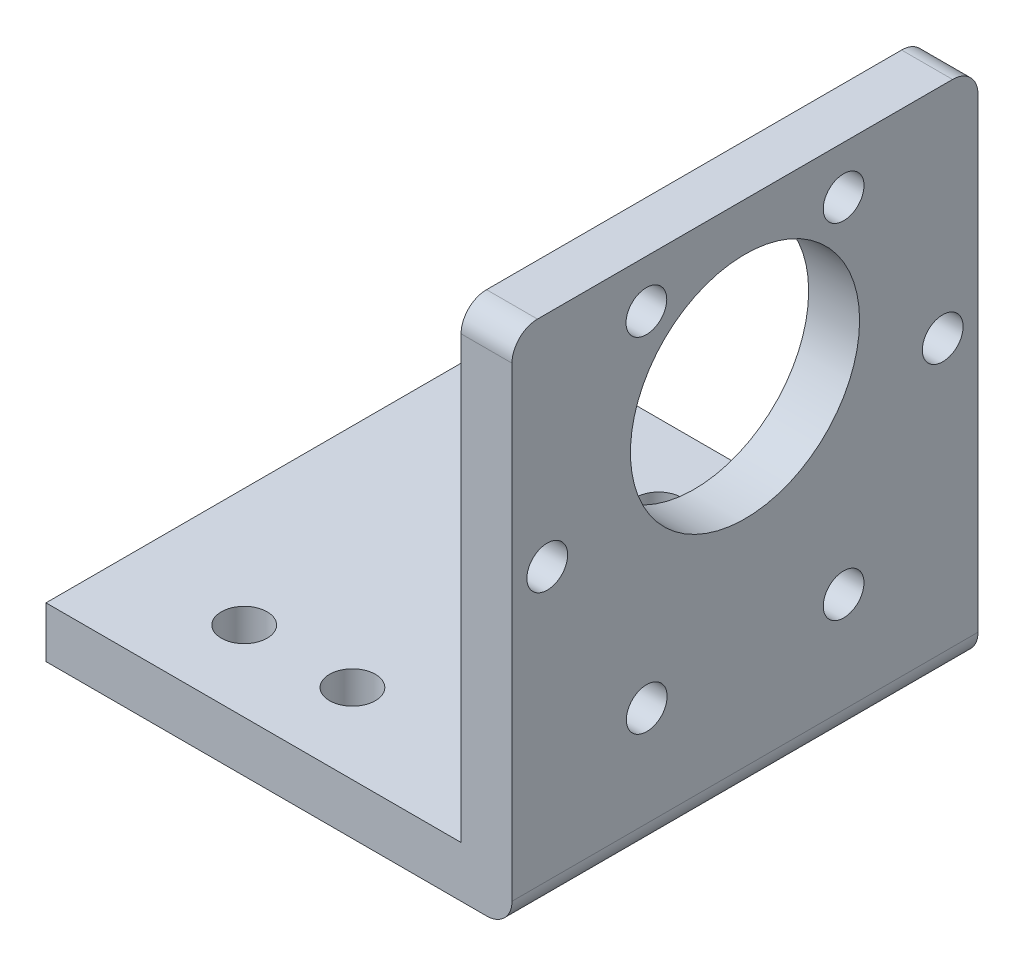
from build123d import *

# Parameters (mm, degrees)
SKETCH_1_W          = 36.6
SKETCH_1_H          = 36.6
EXTRUDE_1_DEPTH     = 40.6
SKETCH_2_W          = 32.6
SKETCH_2_H          = 36.6
CUT_EXTRUDE_1_DEPTH = 36.6
SKETCH_3_R          = 9
SKETCH_3_R_2        = 1.6
CUT_EXTRUDE_5_DEPTH = 36.6
FILLET_1_R          = 2
FILLET_2_R          = 2
SKETCH_7_R          = 1.8
CUT_EXTRUDE_6_DEPTH = 10


with BuildPart() as part:
    # 草图1 → 凸台-拉伸1 (new body)
    with BuildSketch(Plane(origin=(0, 0, 0), x_dir=(1, 0, 0), z_dir=(0, 1, 0))):
        Rectangle(SKETCH_1_W, SKETCH_1_H)
    extrude(amount=EXTRUDE_1_DEPTH)

    # 草图2 → 切除-拉伸1 (cut)
    with BuildSketch(Plane(origin=(0, 40.6, 0), x_dir=(1, 0, 0), z_dir=(0, 1, 0))):
        with Locations((-2, 0)):
            Rectangle(SKETCH_2_W, SKETCH_2_H)
    extrude(amount=-CUT_EXTRUDE_1_DEPTH, mode=Mode.SUBTRACT)

    # 草图3 → 切除-拉伸5 (cut)
    with BuildSketch(Plane(origin=(18.3, 0, 0), x_dir=(0, 0, -1), z_dir=(1, 0, 0))):
        with Locations((0, 27.863666333)):
            Circle(SKETCH_3_R)
        with Locations((-7.745235234, 36.863666333)):
            Circle(SKETCH_3_R_2)
        with Locations((7.745235234, 36.863666333)):
            Circle(SKETCH_3_R_2)
        with Locations((-15.529977583, 23.38009706)):
            Circle(SKETCH_3_R_2)
        with Locations((15.529977583, 23.38009706)):
            Circle(SKETCH_3_R_2)
        with Locations((7.745235234, 9.85104245)):
            Circle(SKETCH_3_R_2)
        with Locations((-7.718974262, 9.85104245)):
            Circle(SKETCH_3_R_2)
    extrude(amount=-CUT_EXTRUDE_5_DEPTH, mode=Mode.SUBTRACT)

    # 圆角1
    fillet_1_edges = [part.edges().sort_by_distance(p)[0] for p in [
        (18.3, 0, 0),
    ]]
    fillet(fillet_1_edges, radius=FILLET_1_R)

    # 圆角2
    fillet_2_edges = [part.edges().sort_by_distance(p)[0] for p in [
        (16.3, 40.6, 18.3),
        (16.3, 40.6, -18.3),
    ]]
    fillet(fillet_2_edges, radius=FILLET_2_R)

    # 草图7 → 切除-拉伸6 (cut)
    with BuildSketch(Plane(origin=(0, 0, 0), x_dir=(-1, 0, 0), z_dir=(0, -1, 0))):
        with Locations(Location((0.50738419, 12.025, 0), (0, 0, 90))):
            Circle(SKETCH_7_R)
        with Locations(Location((9.00738419, 12.025, 0), (0, 0, 90))):
            Circle(SKETCH_7_R)
        with Locations(Location((9.00738419, -12.025, 0), (0, 0, 270))):
            Circle(SKETCH_7_R)
        with Locations(Location((0.50738419, -12.025, 0), (0, 0, 270))):
            Circle(SKETCH_7_R)
    extrude(amount=-CUT_EXTRUDE_6_DEPTH, mode=Mode.SUBTRACT)


solid = part.part
